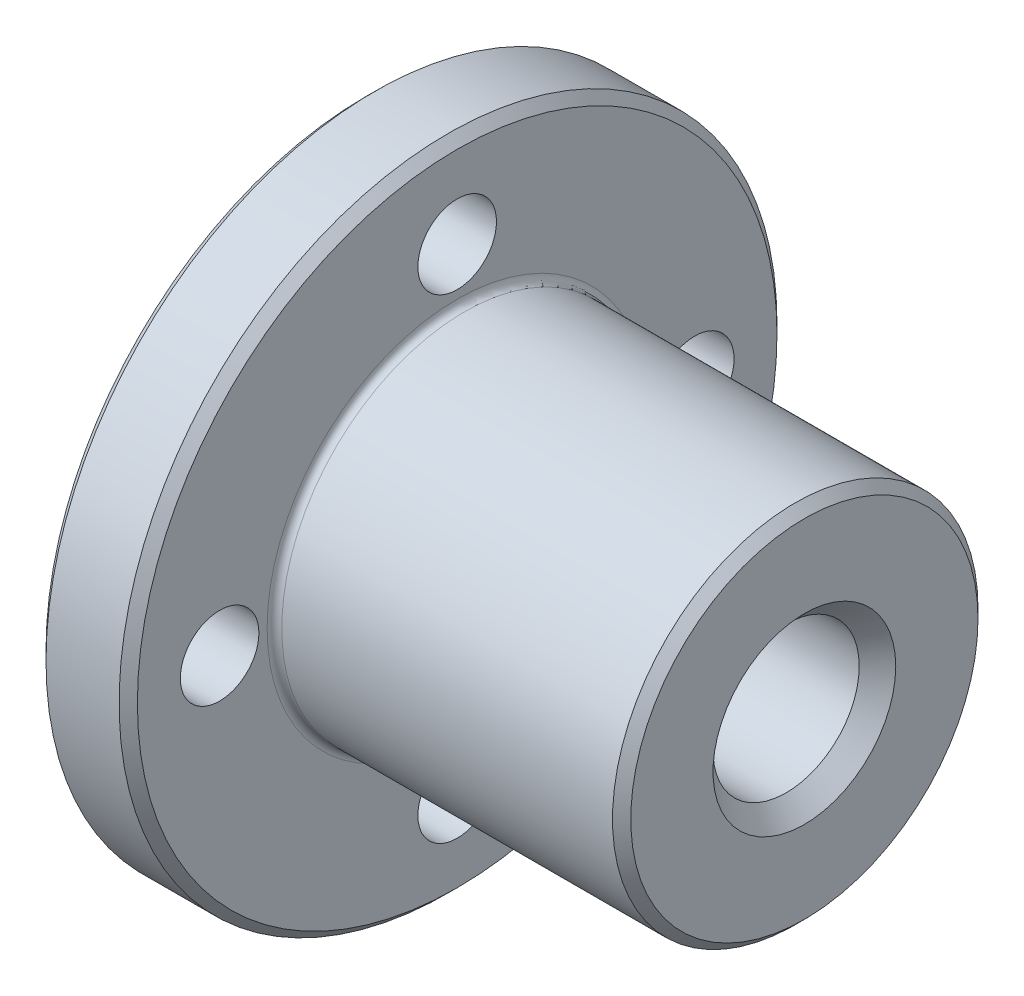
from build123d import *

# Parameters (mm, degrees)
SKETCH1_W                      = 5
SKETCH1_H                      = 18
SKETCH2_R                      = 10
BOSS_EXTRUDE1_DEPTH            = 19
F_4_3_4_3_DIAMETER_HOLE1_D     = 4.3
F_4_3_4_3_DIAMETER_HOLE1_DEPTH = 24
F_8_0_8_DIAMETER_HOLE1_D       = 8
CHAMFER1_SIZE                  = 0.5
CHAMFER2_SIZE                  = 1
FILLET1_R                      = 0.4


with BuildPart() as part:
    # Sketch1 → Revolve1 (revolve)
    with BuildSketch(Plane.XY, mode=Mode.PRIVATE) as revolve1_sk:
        with Locations((2.5, 9)):
            Rectangle(SKETCH1_W, SKETCH1_H)
    revolve(revolve1_sk.sketch.rotate(Axis((0, 0, 0), (1, 0, 0)), 270), axis=Axis((0, 0, 0), (1, 0, 0)))

    # Sketch2 → Boss-Extrude1 (add)
    with BuildSketch(Plane(origin=(5, 0, 0), x_dir=(0, 0, -1), z_dir=(1, 0, 0))):
        Circle(SKETCH2_R)
    extrude(amount=BOSS_EXTRUDE1_DEPTH)

    # Ø4.3 (4.3) Diameter Hole1
    with Locations(Plane.ZY):
        with Locations((0, 13), (0, -13), (-13, 0), (13, 0)):
            Hole(F_4_3_4_3_DIAMETER_HOLE1_D / 2, depth=F_4_3_4_3_DIAMETER_HOLE1_DEPTH)

    # Ø8.0 (8) Diameter Hole1 (through all)
    with Locations(Plane(origin=(24, 0, 0), x_dir=(0, 0, -1), z_dir=(1, 0, 0))):
        with Locations((0, 0)):
            Hole(F_8_0_8_DIAMETER_HOLE1_D / 2)

    # Chamfer1
    chamfer1_edges = [part.edges().sort_by_distance(p)[0] for p in [
        (5, 0, 18),
        (0, 0, 18),
        (24, 0, 10),
    ]]
    chamfer(chamfer1_edges, length=CHAMFER1_SIZE)

    # Chamfer2
    chamfer2_edges = [part.edges().sort_by_distance(p)[0] for p in [
        (24, 0, -4),
        (0, 0, -4),
    ]]
    chamfer(chamfer2_edges, length=CHAMFER2_SIZE)

    # Fillet1
    fillet1_edges = [part.edges().sort_by_distance(p)[0] for p in [
        (5, 0, 10),
    ]]
    fillet(fillet1_edges, radius=FILLET1_R)


solid = part.part
